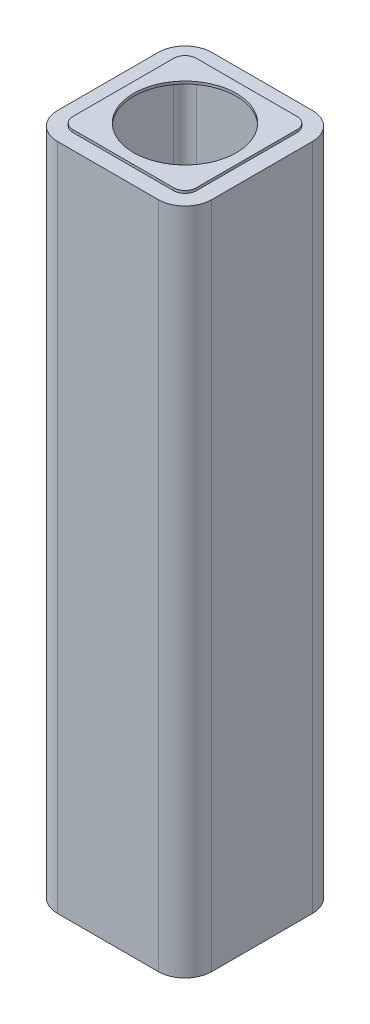
from build123d import *

# Parameters (mm, degrees)
SQUARE_TUBE_30_X_30_X_2_6_1_DEPTH = 130
SKETCH13_R                        = 10
BOSS_EXTRUDE1_DEPTH               = 0.5


with BuildPart() as part:
    # Sketch12 → Square tube 30 X 30 X 2.6(1) (new body)
    with BuildSketch(Plane(origin=(0, 0, 0), x_dir=(1, 0, 0), z_dir=(0, 1, 0))):
        with BuildLine():
            Line((-9.8, -15), (9.8, -15))
            ThreePointArc((9.8, -15), (13.476955262, -13.476955262), (15, -9.8))
            Line((15, -9.8), (15, 9.8))
            ThreePointArc((15, 9.8), (13.476955262, 13.476955262), (9.8, 15))
            Line((9.8, 15), (-9.8, 15))
            ThreePointArc((-9.8, 15), (-13.476955262, 13.476955262), (-15, 9.8))
            Line((-15, 9.8), (-15, -9.8))
            ThreePointArc((-15, -9.8), (-13.476955262, -13.476955262), (-9.8, -15))
        make_face()
        with BuildLine():
            Line((-9.8, -12), (9.8, -12))
            ThreePointArc((9.8, -12), (11.355634919, -11.355634919), (12, -9.8))
            Line((12, -9.8), (12, 9.8))
            ThreePointArc((12, 9.8), (11.355634919, 11.355634919), (9.8, 12))
            Line((9.8, 12), (-9.8, 12))
            ThreePointArc((-9.8, 12), (-11.355634919, 11.355634919), (-12, 9.8))
            Line((-12, 9.8), (-12, -9.8))
            ThreePointArc((-12, -9.8), (-11.355634919, -11.355634919), (-9.8, -12))
        make_face(mode=Mode.SUBTRACT)
    extrude(amount=SQUARE_TUBE_30_X_30_X_2_6_1_DEPTH)


with BuildPart() as body_2:
    # Sketch13 → Boss-Extrude1 (new body)
    with BuildSketch(Plane(origin=(0, 130, 0), x_dir=(1, 0, 0), z_dir=(0, 1, 0))):
        with BuildLine():
            Line((12, -9.8), (12, 9.8))
            ThreePointArc((12, 9.8), (11.355634919, 11.355634919), (9.8, 12))
            Line((9.8, 12), (-9.8, 12))
            ThreePointArc((-9.8, 12), (-11.355634919, 11.355634919), (-12, 9.8))
            Line((-12, 9.8), (-12, -9.8))
            ThreePointArc((-12, -9.8), (-11.355634919, -11.355634919), (-9.8, -12))
            Line((-9.8, -12), (9.8, -12))
            ThreePointArc((9.8, -12), (11.355634919, -11.355634919), (12, -9.8))
        make_face()
        with Locations(Location((0, 0, 0), (0, 0, 270))):
            Circle(SKETCH13_R, mode=Mode.SUBTRACT)
    extrude(amount=BOSS_EXTRUDE1_DEPTH)


solid = Compound([part.part, body_2.part])
